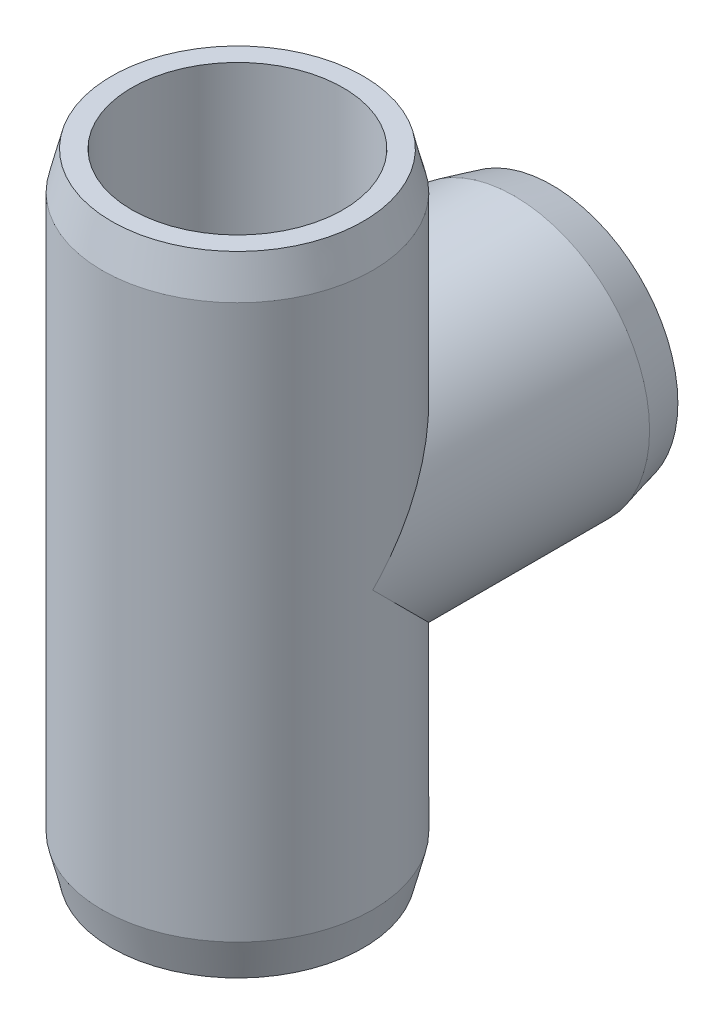
from build123d import *

# Parameters (mm, degrees)
SKETCH1_R                = 13.6525
SKETCH1_R_2              = 10.668
BOSS_EXTRUDE1_DEPTH      = 63.5
SKETCH3_R                = 10.668
CUT_EXTRUDE2_DEPTH       = 69.85
BOSS_EXTRUDE2_REACH      = 81.247
BOSS_EXTRUDE2_END_RADIUS = 13.6525
SKETCH4_R                = 13.6525
SKETCH4_R_2              = 10.668
SKETCH5_W                = 1.905
SKETCH5_H                = 1.27
SKETCH6_W                = 1.27
SKETCH6_H                = 1.905
SKETCH7_W                = 1.27
SKETCH7_H                = 1.905


with BuildPart() as part:
    # Sketch1 → Boss-Extrude1 (new body)
    with BuildSketch(Plane(origin=(0, 0, 0), x_dir=(1, 0, 0), z_dir=(0, 1, 0))):
        with Locations(Location((0, 0, 0), (0, 0, 270))):
            Circle(SKETCH1_R)
        with Locations(Location((0, 0, 0), (0, 0, 270))):
            Circle(SKETCH1_R_2, mode=Mode.SUBTRACT)
    extrude(amount=BOSS_EXTRUDE1_DEPTH)

    # Sketch3 → Cut-Extrude2 (cut)
    with BuildSketch(Plane.XY):
        with Locations((0, 31.75)):
            Circle(SKETCH3_R)
    extrude(amount=-CUT_EXTRUDE2_DEPTH, mode=Mode.SUBTRACT)

    # Boss-Extrude2: up to this cylinder (the profile starts outside it)
    boss_extrude2_end = Plane(origin=(0, 31.75, 0), z_dir=(0, -1, 0)) * Cylinder(BOSS_EXTRUDE2_END_RADIUS, 190.799, mode=Mode.PRIVATE)
    # Sketch4 → Boss-Extrude2 (add, up to the surface)
    with BuildSketch(Plane.XY.offset(-31.75), mode=Mode.PRIVATE) as boss_extrude2_sk1:
        with Locations((0, 31.75)):
            Circle(SKETCH4_R)
        with Locations((0, 31.75)):
            Circle(SKETCH4_R_2, mode=Mode.SUBTRACT)
    boss_extrude2_tool1 = extrude(boss_extrude2_sk1.sketch, amount=BOSS_EXTRUDE2_REACH, mode=Mode.PRIVATE) - boss_extrude2_end
    add(boss_extrude2_tool1.solids().sort_by_distance((-13.266349, 31.75, -31.75))[0])

    # Sketch5 → Revolve1 (revolve)
    with BuildSketch(Plane(origin=(0, 0, 0), x_dir=(0, 0, -1), z_dir=(1, 0, 0)), mode=Mode.PRIVATE) as revolve1_sk:
        with Locations((11.7475, 21.717)):
            Rectangle(SKETCH5_W, SKETCH5_H)
    revolve(revolve1_sk.sketch.rotate(Axis((0, 31.75, -31.75), (0, 0, 1)), 90), axis=Axis((0, 31.75, -31.75), (0, 0, 1)))

    # Sketch6 → Revolve2 (revolve)
    with BuildSketch(Plane(origin=(0, 0, 0), x_dir=(0, 0, -1), z_dir=(1, 0, 0)), mode=Mode.PRIVATE) as revolve2_sk:
        with Locations((10.033, 43.4975)):
            Rectangle(SKETCH6_W, SKETCH6_H)
    revolve(revolve2_sk.sketch.rotate(Axis((0, 63.5, 0), (0, -1, 0)), 180), axis=Axis((0, 63.5, 0), (0, -1, 0)))

    # Sketch7 → Revolve3 (revolve)
    with BuildSketch(Plane(origin=(0, 0, 0), x_dir=(0, 0, -1), z_dir=(1, 0, 0)), mode=Mode.PRIVATE) as revolve3_sk:
        with Locations((-10.033, 20.0025)):
            Rectangle(SKETCH7_W, SKETCH7_H)
    revolve(revolve3_sk.sketch.rotate(Axis((0, 0, 0), (0, 1, 0)), 180), axis=Axis((0, 0, 0), (0, 1, 0)))

    # Sketch8 → Cut-Revolve1 (revolve, cut)
    with BuildSketch(Plane.XY, mode=Mode.PRIVATE) as cut_revolve1_sk:
        Polygon((13.6525, 0), (13.6525, 3.81), (12.7, 0), align=None)
    cut_revolve1 = revolve(cut_revolve1_sk.sketch.rotate(Axis((0, 0, 0), (0, 1, 0)), 90), axis=Axis((0, 0, 0), (0, 1, 0)), mode=Mode.SUBTRACT)

    # Mirror1: Cut-Revolve1 across plane
    add(cut_revolve1.mirror(Plane.ZX.offset(31.75)), mode=Mode.SUBTRACT)

    # Sketch9 → Cut-Revolve2 (revolve, cut)
    with BuildSketch(Plane(origin=(0, 0, 0), x_dir=(0, 0, -1), z_dir=(1, 0, 0)), mode=Mode.PRIVATE) as cut_revolve2_sk:
        Polygon((31.75, 18.0975), (27.94, 18.0975), (31.75, 19.05), align=None)
    revolve(cut_revolve2_sk.sketch.rotate(Axis((0, 31.75, -31.75), (0, 0, 1)), 270), axis=Axis((0, 31.75, -31.75), (0, 0, 1)), mode=Mode.SUBTRACT)


solid = part.part
